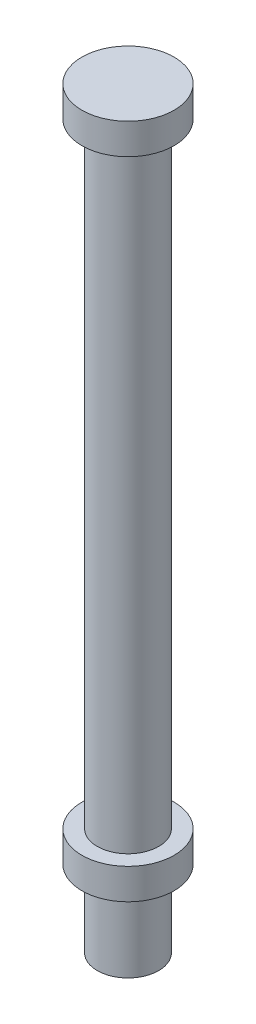
from build123d import *

# Parameters (mm, degrees)
SKETCH3_R           = 20
BOSS_EXTRUDE4_DEPTH = 400
SKETCH13_R          = 30
BOSS_EXTRUDE5_DEPTH = 20
BOSS_EXTRUDE6_START = 20
SKETCH14_R          = 30
BOSS_EXTRUDE6_DEPTH = 20
BOSS_EXTRUDE7_START = 50
SKETCH15_R          = 20
BOSS_EXTRUDE7_DEPTH = 50


with BuildPart() as part:
    # Sketch3 → Boss-Extrude4 (new body)
    with BuildSketch(Plane(origin=(0, 0, 0), x_dir=(1, 0, 0), z_dir=(0, 1, 0))):
        Circle(SKETCH3_R)
    extrude(amount=BOSS_EXTRUDE4_DEPTH)

    # Sketch13 → Boss-Extrude5 (add)
    with BuildSketch(Plane(origin=(0, 400, 0), x_dir=(1, 0, 0), z_dir=(0, 1, 0))):
        Circle(SKETCH13_R)
    extrude(amount=BOSS_EXTRUDE5_DEPTH)

    # Sketch14 → Boss-Extrude6 (add)
    with BuildSketch(Plane.XZ.offset(BOSS_EXTRUDE6_START)):
        Circle(SKETCH14_R)
    extrude(amount=-BOSS_EXTRUDE6_DEPTH)

    # Sketch15 → Boss-Extrude7 (add)
    with BuildSketch(Plane.XZ.offset(20).offset(BOSS_EXTRUDE7_START)):
        Circle(SKETCH15_R)
    extrude(amount=-BOSS_EXTRUDE7_DEPTH)


solid = part.part
